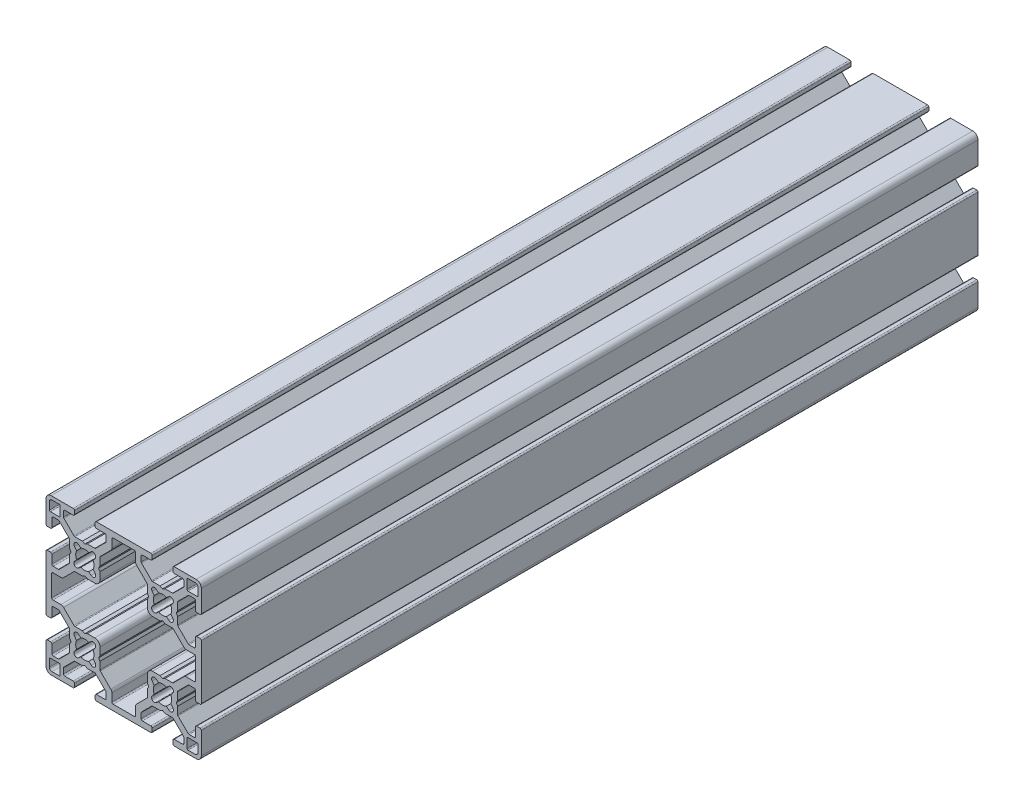
from build123d import *

# Parameters (mm, degrees)
EXTRUDE1_DEPTH = 300


with BuildPart() as part:
    # Sketch1 → Extrude1 (new body)
    with BuildSketch(Plane.XY):
        with BuildLine():
            Line((-44.499910604, -25.999939138), (-43.242439395, -25.999939138))
            ThreePointArc((-43.242439395, -25.999939138), (-42.888886712, -25.853492822), (-42.742440395, -25.499940138))
            Line((-42.742440395, -25.499940138), (-42.742440395, -22.267405228))
            ThreePointArc((-42.742440395, -22.267405228), (-42.602415161, -21.902627025), (-42.242745981, -21.749956517))
            Line((-42.242745981, -21.749956517), (-40.260148569, -21.749956517))
            ThreePointArc((-40.260148569, -21.749956517), (-40.068807235, -21.788016674), (-39.906595885, -21.896402833))
            Line((-39.906595885, -21.896402833), (-35.981069743, -25.821928975))
            ThreePointArc((-35.981069743, -25.821928975), (-35.872683584, -25.984140325), (-35.834623427, -26.175481659))
            Line((-35.834623427, -26.175481659), (-35.834623427, -29.112441775))
            Line((-35.834623427, -29.112441775), (-35.324624435, -30.062439875))
            Line((-35.324624435, -30.062439875), (-35.834623427, -31.012437975))
            Line((-35.834623427, -31.012437975), (-35.834623427, -33.824398373))
            ThreePointArc((-35.834623427, -33.824398373), (-35.872683584, -34.015739706), (-35.981069743, -34.177951056))
            Line((-35.981069743, -34.177951056), (-39.906595885, -38.103477198))
            ThreePointArc((-39.906595885, -38.103477198), (-40.068807235, -38.211863357), (-40.260148569, -38.249923515))
            Line((-40.260148569, -38.249923515), (-42.242745981, -38.249923515))
            ThreePointArc((-42.242745981, -38.249923515), (-42.602415161, -38.097253006), (-42.742440395, -37.732474804))
            Line((-42.742440395, -37.732474804), (-42.742440395, -34.499939893))
            ThreePointArc((-42.742440395, -34.499939893), (-42.888886712, -34.14638721), (-43.242439395, -33.999940893))
            Line((-43.242439395, -33.999940893), (-44.499910604, -33.999940893))
            ThreePointArc((-44.499910604, -33.999940893), (-44.853463287, -34.14638721), (-44.999909604, -34.499939893))
            Line((-44.999909604, -34.499939893), (-44.999909604, -42.999913979))
            ThreePointArc((-44.999909604, -42.999913979), (-44.414124448, -44.414124448), (-42.999913979, -44.999909604))
            Line((-42.999913979, -44.999909604), (-34.499939893, -44.999909604))
            ThreePointArc((-34.499939893, -44.999909604), (-34.14638721, -44.853463287), (-33.999940893, -44.499910604))
            Line((-33.999940893, -44.499910604), (-33.999940893, -43.242439395))
            ThreePointArc((-33.999940893, -43.242439395), (-34.14638721, -42.888886712), (-34.499939893, -42.742440395))
            Line((-34.499939893, -42.742440395), (-37.732474804, -42.742440395))
            ThreePointArc((-37.732474804, -42.742440395), (-38.097253006, -42.602415161), (-38.249923515, -42.242745981))
            Line((-38.249923515, -42.242745981), (-38.249923515, -40.260148569))
            ThreePointArc((-38.249923515, -40.260148569), (-38.211863357, -40.068807235), (-38.103477198, -39.906595885))
            Line((-38.103477198, -39.906595885), (-34.177951056, -35.981069743))
            ThreePointArc((-34.177951056, -35.981069743), (-34.015739706, -35.872683584), (-33.824398373, -35.834623427))
            Line((-33.824398373, -35.834623427), (-30.9499381, -35.834623427))
            Line((-30.9499381, -35.834623427), (-29.999940016, -35.324624405))
            Line((-29.999940016, -35.324624405), (-29.049941932, -35.834623427))
            Line((-29.049941932, -35.834623427), (-26.175481659, -35.834623427))
            ThreePointArc((-26.175481659, -35.834623427), (-25.984140325, -35.872683584), (-25.821928975, -35.981069743))
            Line((-25.821928975, -35.981069743), (-21.896402833, -39.906595885))
            ThreePointArc((-21.896402833, -39.906595885), (-21.788016674, -40.068807235), (-21.749956517, -40.260148569))
            Line((-21.749956517, -40.260148569), (-21.749956517, -42.242745981))
            ThreePointArc((-21.749956517, -42.242745981), (-21.902627025, -42.602415161), (-22.267405228, -42.742440395))
            Line((-22.267405228, -42.742440395), (-25.499940138, -42.742440395))
            ThreePointArc((-25.499940138, -42.742440395), (-25.853492822, -42.888886712), (-25.999939138, -43.242439395))
            Line((-25.999939138, -43.242439395), (-25.999939138, -44.499910604))
            ThreePointArc((-25.999939138, -44.499910604), (-25.853492822, -44.853463287), (-25.499940138, -44.999909604))
            Line((-25.499940138, -44.999909604), (-4.499999878, -44.999909604))
            ThreePointArc((-4.499999878, -44.999909604), (-4.146447194, -44.853463287), (-4.000000878, -44.499910604))
            Line((-4.000000878, -44.499910604), (-4.000000878, -43.242439395))
            ThreePointArc((-4.000000878, -43.242439395), (-4.146447194, -42.888886712), (-4.499999878, -42.742440395))
            Line((-4.499999878, -42.742440395), (-7.732534789, -42.742440395))
            ThreePointArc((-7.732534789, -42.742440395), (-8.097312991, -42.602415161), (-8.2499835, -42.242745981))
            Line((-8.2499835, -42.242745981), (-8.2499835, -40.260148569))
            ThreePointArc((-8.2499835, -40.260148569), (-8.211923342, -40.068807235), (-8.103537183, -39.906595885))
            Line((-8.103537183, -39.906595885), (-4.178011041, -35.981069743))
            ThreePointArc((-4.178011041, -35.981069743), (-4.015799691, -35.872683584), (-3.824458357, -35.834623427))
            Line((-3.824458357, -35.834623427), (-0.949998085, -35.834623427))
            Line((-0.949998085, -35.834623427), (0, -35.324624405))
            Line((0, -35.324624405), (0.949998084, -35.834623427))
            Line((0.949998084, -35.834623427), (3.824458357, -35.834623427))
            ThreePointArc((3.824458357, -35.834623427), (4.01579969, -35.872683584), (4.17801104, -35.981069743))
            Line((4.17801104, -35.981069743), (8.103537182, -39.906595885))
            ThreePointArc((8.103537182, -39.906595885), (8.211923341, -40.068807235), (8.249983499, -40.260148569))
            Line((8.249983499, -40.260148569), (8.249983499, -42.242745981))
            ThreePointArc((8.249983499, -42.242745981), (8.09731299, -42.602415161), (7.732534788, -42.742440395))
            Line((7.732534788, -42.742440395), (4.499999877, -42.742440395))
            ThreePointArc((4.499999877, -42.742440395), (4.146447193, -42.888886712), (4.000000877, -43.242439395))
            Line((4.000000877, -43.242439395), (4.000000877, -44.499910604))
            ThreePointArc((4.000000877, -44.499910604), (4.146447193, -44.853463287), (4.499999877, -44.999909604))
            Line((4.499999877, -44.999909604), (12.999973963, -44.999909604))
            ThreePointArc((12.999973963, -44.999909604), (14.414184432, -44.414124448), (14.999969588, -42.999913979))
            Line((14.999969588, -42.999913979), (14.999969588, -34.499939893))
            ThreePointArc((14.999969588, -34.499939893), (14.853523271, -34.14638721), (14.499970588, -33.999940893))
            Line((14.499970588, -33.999940893), (13.242499379, -33.999940893))
            ThreePointArc((13.242499379, -33.999940893), (12.888946695, -34.14638721), (12.742500379, -34.499939893))
            Line((12.742500379, -34.499939893), (12.742500379, -37.732474804))
            ThreePointArc((12.742500379, -37.732474804), (12.602475145, -38.097253006), (12.242805965, -38.249923515))
            Line((12.242805965, -38.249923515), (10.260208553, -38.249923515))
            ThreePointArc((10.260208553, -38.249923515), (10.068867219, -38.211863357), (9.906655869, -38.103477198))
            Line((9.906655869, -38.103477198), (5.981129727, -34.177951056))
            ThreePointArc((5.981129727, -34.177951056), (5.872743568, -34.015739706), (5.834683411, -33.824398373))
            Line((5.834683411, -33.824398373), (5.834683411, -31.012437975))
            Line((5.834683411, -31.012437975), (5.324684418, -30.062439875))
            Line((5.324684418, -30.062439875), (5.834683411, -29.112441775))
            Line((5.834683411, -29.112441775), (5.834683411, -26.175481659))
            ThreePointArc((5.834683411, -26.175481659), (5.872743568, -25.984140325), (5.981129727, -25.821928975))
            Line((5.981129727, -25.821928975), (9.906655869, -21.896402833))
            ThreePointArc((9.906655869, -21.896402833), (10.068867219, -21.788016674), (10.260208553, -21.749956517))
            Line((10.260208553, -21.749956517), (12.242805965, -21.749956517))
            ThreePointArc((12.242805965, -21.749956517), (12.602475145, -21.902627025), (12.742500379, -22.267405228))
            Line((12.742500379, -22.267405228), (12.742500379, -25.499940138))
            ThreePointArc((12.742500379, -25.499940138), (12.888946695, -25.853492822), (13.242499379, -25.999939138))
            Line((13.242499379, -25.999939138), (14.499970588, -25.999939138))
            ThreePointArc((14.499970588, -25.999939138), (14.853523271, -25.853492822), (14.999969588, -25.499940138))
            Line((14.999969588, -25.499940138), (14.999969588, -4.499999878))
            ThreePointArc((14.999969588, -4.499999878), (14.853523271, -4.146447194), (14.499970588, -4.000000878))
            Line((14.499970588, -4.000000878), (13.242499379, -4.000000878))
            ThreePointArc((13.242499379, -4.000000878), (12.888946695, -4.146447194), (12.742500379, -4.499999878))
            Line((12.742500379, -4.499999878), (12.742500379, -7.732534789))
            ThreePointArc((12.742500379, -7.732534789), (12.602475145, -8.097312991), (12.242805965, -8.2499835))
            Line((12.242805965, -8.2499835), (10.260208553, -8.2499835))
            ThreePointArc((10.260208553, -8.2499835), (10.068867219, -8.211923342), (9.906655869, -8.103537183))
            Line((9.906655869, -8.103537183), (5.981129727, -4.178011041))
            ThreePointArc((5.981129727, -4.178011041), (5.872743568, -4.015799691), (5.834683411, -3.824458357))
            Line((5.834683411, -3.824458357), (5.834683411, -1.01249796))
            Line((5.834683411, -1.01249796), (5.324684418, -0.06249986))
            Line((5.324684418, -0.06249986), (5.834683411, 0.88749824))
            Line((5.834683411, 0.88749824), (5.834683411, 3.824458357))
            ThreePointArc((5.834683411, 3.824458357), (5.872743568, 4.01579969), (5.981129727, 4.17801104))
            Line((5.981129727, 4.17801104), (9.906655869, 8.103537182))
            ThreePointArc((9.906655869, 8.103537182), (10.068867219, 8.211923341), (10.260208553, 8.249983499))
            Line((10.260208553, 8.249983499), (12.242805965, 8.249983499))
            ThreePointArc((12.242805965, 8.249983499), (12.602475145, 8.09731299), (12.742500379, 7.732534788))
            Line((12.742500379, 7.732534788), (12.742500379, 4.499999877))
            ThreePointArc((12.742500379, 4.499999877), (12.888946695, 4.146447193), (13.242499379, 4.000000877))
            Line((13.242499379, 4.000000877), (14.499970588, 4.000000877))
            ThreePointArc((14.499970588, 4.000000877), (14.853523271, 4.146447193), (14.999969588, 4.499999877))
            Line((14.999969588, 4.499999877), (14.999969588, 12.999973963))
            ThreePointArc((14.999969588, 12.999973963), (14.414184432, 14.414184432), (12.999973963, 14.999969588))
            Line((12.999973963, 14.999969588), (4.499999877, 14.999969588))
            ThreePointArc((4.499999877, 14.999969588), (4.146447193, 14.853523271), (4.000000877, 14.499970588))
            Line((4.000000877, 14.499970588), (4.000000877, 13.242499379))
            ThreePointArc((4.000000877, 13.242499379), (4.146447193, 12.888946695), (4.499999877, 12.742500379))
            Line((4.499999877, 12.742500379), (7.732534788, 12.742500379))
            ThreePointArc((7.732534788, 12.742500379), (8.09731299, 12.602475145), (8.249983499, 12.242805965))
            Line((8.249983499, 12.242805965), (8.249983499, 10.260208553))
            ThreePointArc((8.249983499, 10.260208553), (8.211923341, 10.068867219), (8.103537182, 9.906655869))
            Line((8.103537182, 9.906655869), (4.17801104, 5.981129727))
            ThreePointArc((4.17801104, 5.981129727), (4.01579969, 5.872743568), (3.824458357, 5.834683411))
            Line((3.824458357, 5.834683411), (0.949998084, 5.834683411))
            Line((0.949998084, 5.834683411), (0, 5.324684389))
            Line((0, 5.324684389), (-0.949998085, 5.834683411))
            Line((-0.949998085, 5.834683411), (-3.824458357, 5.834683411))
            ThreePointArc((-3.824458357, 5.834683411), (-4.015799691, 5.872743568), (-4.178011041, 5.981129727))
            Line((-4.178011041, 5.981129727), (-8.103537183, 9.906655869))
            ThreePointArc((-8.103537183, 9.906655869), (-8.211923342, 10.068867219), (-8.2499835, 10.260208553))
            Line((-8.2499835, 10.260208553), (-8.2499835, 12.242805965))
            ThreePointArc((-8.2499835, 12.242805965), (-8.097312991, 12.602475145), (-7.732534789, 12.742500379))
            Line((-7.732534789, 12.742500379), (-4.499999878, 12.742500379))
            ThreePointArc((-4.499999878, 12.742500379), (-4.146447194, 12.888946695), (-4.000000878, 13.242499379))
            Line((-4.000000878, 13.242499379), (-4.000000878, 14.499970588))
            ThreePointArc((-4.000000878, 14.499970588), (-4.146447194, 14.853523271), (-4.499999878, 14.999969588))
            Line((-4.499999878, 14.999969588), (-25.499940138, 14.999969588))
            ThreePointArc((-25.499940138, 14.999969588), (-25.853492822, 14.853523271), (-25.999939138, 14.499970588))
            Line((-25.999939138, 14.499970588), (-25.999939138, 13.242499379))
            ThreePointArc((-25.999939138, 13.242499379), (-25.853492822, 12.888946695), (-25.499940138, 12.742500379))
            Line((-25.499940138, 12.742500379), (-22.267405228, 12.742500379))
            ThreePointArc((-22.267405228, 12.742500379), (-21.902627025, 12.602475145), (-21.749956517, 12.242805965))
            Line((-21.749956517, 12.242805965), (-21.749956517, 10.260208553))
            ThreePointArc((-21.749956517, 10.260208553), (-21.788016674, 10.068867219), (-21.896402833, 9.906655869))
            Line((-21.896402833, 9.906655869), (-25.821928975, 5.981129727))
            ThreePointArc((-25.821928975, 5.981129727), (-25.984140325, 5.872743568), (-26.175481659, 5.834683411))
            Line((-26.175481659, 5.834683411), (-29.049941932, 5.834683411))
            Line((-29.049941932, 5.834683411), (-29.999940016, 5.324684389))
            Line((-29.999940016, 5.324684389), (-30.9499381, 5.834683411))
            Line((-30.9499381, 5.834683411), (-33.824398373, 5.834683411))
            ThreePointArc((-33.824398373, 5.834683411), (-34.015739706, 5.872743568), (-34.177951056, 5.981129727))
            Line((-34.177951056, 5.981129727), (-38.103477198, 9.906655869))
            ThreePointArc((-38.103477198, 9.906655869), (-38.211863357, 10.068867219), (-38.249923515, 10.260208553))
            Line((-38.249923515, 10.260208553), (-38.249923515, 12.242805965))
            ThreePointArc((-38.249923515, 12.242805965), (-38.097253006, 12.602475145), (-37.732474804, 12.742500379))
            Line((-37.732474804, 12.742500379), (-34.499939893, 12.742500379))
            ThreePointArc((-34.499939893, 12.742500379), (-34.14638721, 12.888946695), (-33.999940893, 13.242499379))
            Line((-33.999940893, 13.242499379), (-33.999940893, 14.499970588))
            ThreePointArc((-33.999940893, 14.499970588), (-34.14638721, 14.853523271), (-34.499939893, 14.999969588))
            Line((-34.499939893, 14.999969588), (-42.999913979, 14.999969588))
            ThreePointArc((-42.999913979, 14.999969588), (-44.414124448, 14.414184432), (-44.999909604, 12.999973963))
            Line((-44.999909604, 12.999973963), (-44.999909604, 4.499999877))
            ThreePointArc((-44.999909604, 4.499999877), (-44.853463287, 4.146447193), (-44.499910604, 4.000000877))
            Line((-44.499910604, 4.000000877), (-43.242439395, 4.000000877))
            ThreePointArc((-43.242439395, 4.000000877), (-42.888886712, 4.146447193), (-42.742440395, 4.499999877))
            Line((-42.742440395, 4.499999877), (-42.742440395, 7.732534788))
            ThreePointArc((-42.742440395, 7.732534788), (-42.602415161, 8.09731299), (-42.242745981, 8.249983499))
            Line((-42.242745981, 8.249983499), (-40.260148569, 8.249983499))
            ThreePointArc((-40.260148569, 8.249983499), (-40.068807235, 8.211923341), (-39.906595885, 8.103537182))
            Line((-39.906595885, 8.103537182), (-35.981069743, 4.17801104))
            ThreePointArc((-35.981069743, 4.17801104), (-35.872683584, 4.01579969), (-35.834623427, 3.824458357))
            Line((-35.834623427, 3.824458357), (-35.834623427, 0.88749824))
            Line((-35.834623427, 0.88749824), (-35.324624435, -0.06249986))
            Line((-35.324624435, -0.06249986), (-35.834623427, -1.01249796))
            Line((-35.834623427, -1.01249796), (-35.834623427, -3.824458357))
            ThreePointArc((-35.834623427, -3.824458357), (-35.872683584, -4.015799691), (-35.981069743, -4.178011041))
            Line((-35.981069743, -4.178011041), (-39.906595885, -8.103537183))
            ThreePointArc((-39.906595885, -8.103537183), (-40.068807235, -8.211923342), (-40.260148569, -8.2499835))
            Line((-40.260148569, -8.2499835), (-42.242745981, -8.2499835))
            ThreePointArc((-42.242745981, -8.2499835), (-42.602415161, -8.097312991), (-42.742440395, -7.732534789))
            Line((-42.742440395, -7.732534789), (-42.742440395, -4.499999878))
            ThreePointArc((-42.742440395, -4.499999878), (-42.888886712, -4.146447194), (-43.242439395, -4.000000878))
            Line((-43.242439395, -4.000000878), (-44.499910604, -4.000000878))
            ThreePointArc((-44.499910604, -4.000000878), (-44.853463287, -4.146447194), (-44.999909604, -4.499999878))
            Line((-44.999909604, -4.499999878), (-44.999909604, -25.499940138))
            ThreePointArc((-44.999909604, -25.499940138), (-44.853463287, -25.853492822), (-44.499910604, -25.999939138))
        make_face()
        with BuildLine():
            Line((12.7999744, -19.0499619), (12.7999744, -10.9499781))
            ThreePointArc((12.7999744, -10.9499781), (12.653528083, -10.596425417), (12.2999754, -10.4499791))
            Line((12.2999754, -10.4499791), (9.268179515, -10.4499791))
            ThreePointArc((9.268179515, -10.4499791), (8.694155515, -10.335798627), (8.207521465, -10.010640151))
            Line((8.207521465, -10.010640151), (4.178011045, -5.981129731))
            ThreePointArc((4.178011045, -5.981129731), (4.015799695, -5.872743572), (3.824458362, -5.834683414))
            Line((3.824458362, -5.834683414), (0.949998089, -5.834683414))
            Line((0.949998089, -5.834683414), (-1.6e-08, -5.324684432))
            Line((-1.6e-08, -5.324684432), (-0.949998121, -5.834683414))
            Line((-0.949998121, -5.834683414), (-3.83468779, -5.834683414))
            ThreePointArc((-3.83468779, -5.834683414), (-5.248898258, -5.248898258), (-5.834683414, -3.83468779))
            Line((-5.834683414, -3.83468779), (-5.834683414, -1.012497965))
            Line((-5.834683414, -1.012497965), (-5.324684432, -0.06249986))
            Line((-5.324684432, -0.06249986), (-5.834683414, 0.887498245))
            Line((-5.834683414, 0.887498245), (-5.834683414, 3.824458362))
            ThreePointArc((-5.834683414, 3.824458362), (-5.872743572, 4.015799695), (-5.981129731, 4.178011045))
            Line((-5.981129731, 4.178011045), (-10.01064015, 8.207521465))
            ThreePointArc((-10.01064015, 8.207521465), (-10.335798627, 8.694155515), (-10.4499791, 9.268179515))
            Line((-10.4499791, 9.268179515), (-10.4499791, 12.2999754))
            ThreePointArc((-10.4499791, 12.2999754), (-10.596425417, 12.653528083), (-10.9499781, 12.7999744))
            Line((-10.9499781, 12.7999744), (-19.0499619, 12.7999744))
            ThreePointArc((-19.0499619, 12.7999744), (-19.403514583, 12.653528083), (-19.5499609, 12.2999754))
            Line((-19.5499609, 12.2999754), (-19.5499609, 9.268179515))
            ThreePointArc((-19.5499609, 9.268179515), (-19.664141373, 8.694155515), (-19.98929985, 8.207521465))
            Line((-19.98929985, 8.207521465), (-24.018810269, 4.178011045))
            ThreePointArc((-24.018810269, 4.178011045), (-24.127196428, 4.015799695), (-24.165256586, 3.824458362))
            Line((-24.165256586, 3.824458362), (-24.165256586, 0.887498245))
            Line((-24.165256586, 0.887498245), (-24.675255568, -0.06249986))
            Line((-24.675255568, -0.06249986), (-24.165256586, -1.012497965))
            Line((-24.165256586, -1.012497965), (-24.165256586, -3.83468779))
            ThreePointArc((-24.165256586, -3.83468779), (-24.751041742, -5.248898258), (-26.16525221, -5.834683414))
            Line((-26.16525221, -5.834683414), (-29.049941879, -5.834683414))
            Line((-29.049941879, -5.834683414), (-29.999939984, -5.324684432))
            Line((-29.999939984, -5.324684432), (-30.949938089, -5.834683414))
            Line((-30.949938089, -5.834683414), (-33.824398362, -5.834683414))
            ThreePointArc((-33.824398362, -5.834683414), (-34.015739695, -5.872743572), (-34.177951045, -5.981129731))
            Line((-34.177951045, -5.981129731), (-38.207461465, -10.010640151))
            ThreePointArc((-38.207461465, -10.010640151), (-38.694095515, -10.335798627), (-39.268119515, -10.4499791))
            Line((-39.268119515, -10.4499791), (-42.2999154, -10.4499791))
            ThreePointArc((-42.2999154, -10.4499791), (-42.653468083, -10.596425417), (-42.7999144, -10.9499781))
            Line((-42.7999144, -10.9499781), (-42.7999144, -19.0499619))
            ThreePointArc((-42.7999144, -19.0499619), (-42.653468083, -19.403514584), (-42.2999154, -19.5499609))
            Line((-42.2999154, -19.5499609), (-39.268119515, -19.5499609))
            ThreePointArc((-39.268119515, -19.5499609), (-38.694095515, -19.664141373), (-38.207461465, -19.98929985))
            Line((-38.207461465, -19.98929985), (-34.177951045, -24.018810269))
            ThreePointArc((-34.177951045, -24.018810269), (-34.015739695, -24.127196428), (-33.824398362, -24.165256586))
            Line((-33.824398362, -24.165256586), (-30.949938089, -24.165256586))
            Line((-30.949938089, -24.165256586), (-29.999939984, -24.675255568))
            Line((-29.999939984, -24.675255568), (-29.049941879, -24.165256586))
            Line((-29.049941879, -24.165256586), (-26.16525221, -24.165256586))
            ThreePointArc((-26.16525221, -24.165256586), (-24.751041742, -24.751041742), (-24.165256586, -26.16525221))
            Line((-24.165256586, -26.16525221), (-24.165256586, -29.112441754))
            Line((-24.165256586, -29.112441754), (-24.675255568, -30.062439859))
            Line((-24.675255568, -30.062439859), (-24.165256586, -31.012437964))
            Line((-24.165256586, -31.012437964), (-24.165256586, -33.824398362))
            ThreePointArc((-24.165256586, -33.824398362), (-24.127196428, -34.015739695), (-24.018810269, -34.177951045))
            Line((-24.018810269, -34.177951045), (-19.98929985, -38.207461465))
            ThreePointArc((-19.98929985, -38.207461465), (-19.664141373, -38.694095515), (-19.5499609, -39.268119515))
            Line((-19.5499609, -39.268119515), (-19.5499609, -42.2999154))
            ThreePointArc((-19.5499609, -42.2999154), (-19.403514583, -42.653468084), (-19.0499619, -42.7999144))
            Line((-19.0499619, -42.7999144), (-10.9499781, -42.7999144))
            ThreePointArc((-10.9499781, -42.7999144), (-10.596425417, -42.653468084), (-10.4499791, -42.2999154))
            Line((-10.4499791, -42.2999154), (-10.4499791, -39.268119515))
            ThreePointArc((-10.4499791, -39.268119515), (-10.335798627, -38.694095515), (-10.01064015, -38.207461465))
            Line((-10.01064015, -38.207461465), (-5.981129731, -34.177951045))
            ThreePointArc((-5.981129731, -34.177951045), (-5.872743572, -34.015739695), (-5.834683414, -33.824398362))
            Line((-5.834683414, -33.824398362), (-5.834683414, -31.012437964))
            Line((-5.834683414, -31.012437964), (-5.324684432, -30.062439859))
            Line((-5.324684432, -30.062439859), (-5.834683414, -29.112441754))
            Line((-5.834683414, -29.112441754), (-5.834683414, -26.16525221))
            ThreePointArc((-5.834683414, -26.16525221), (-5.248898258, -24.751041742), (-3.83468779, -24.165256586))
            Line((-3.83468779, -24.165256586), (-0.949998121, -24.165256586))
            Line((-0.949998121, -24.165256586), (-1.6e-08, -24.675255568))
            Line((-1.6e-08, -24.675255568), (0.949998089, -24.165256586))
            Line((0.949998089, -24.165256586), (3.824458362, -24.165256586))
            ThreePointArc((3.824458362, -24.165256586), (4.015799695, -24.127196428), (4.178011045, -24.018810269))
            Line((4.178011045, -24.018810269), (8.207521465, -19.98929985))
            ThreePointArc((8.207521465, -19.98929985), (8.694155515, -19.664141373), (9.268179515, -19.5499609))
            Line((9.268179515, -19.5499609), (12.2999754, -19.5499609))
            ThreePointArc((12.2999754, -19.5499609), (12.653528083, -19.403514584), (12.7999744, -19.0499619))
        make_face(mode=Mode.SUBTRACT)
        with BuildLine():
            Line((-2.473346769, -33.979875105), (-1.494228237, -33.198085108))
            ThreePointArc((-1.494228237, -33.198085108), (0, -33.52993294), (1.494228236, -33.198085108))
            Line((1.494228236, -33.198085108), (2.473346769, -33.979875105))
            ThreePointArc((2.473346769, -33.979875105), (3.900235502, -33.900175502), (3.979935105, -32.473286769))
            Line((3.979935105, -32.473286769), (3.198145108, -31.494168236))
            ThreePointArc((3.198145108, -31.494168236), (3.52999294, -29.99994), (3.198145108, -28.505711763))
            Line((3.198145108, -28.505711763), (3.979935105, -27.526593231))
            ThreePointArc((3.979935105, -27.526593231), (3.900235502, -26.099704498), (2.473346769, -26.020004895))
            Line((2.473346769, -26.020004895), (1.494228237, -26.801794892))
            ThreePointArc((1.494228237, -26.801794892), (0, -26.46994706), (-1.494228237, -26.801794892))
            Line((-1.494228237, -26.801794892), (-2.473346769, -26.020004895))
            ThreePointArc((-2.473346769, -26.020004895), (-3.900235502, -26.099704498), (-3.979935105, -27.526593231))
            Line((-3.979935105, -27.526593231), (-3.198145108, -28.505711763))
            ThreePointArc((-3.198145108, -28.505711763), (-3.52999294, -29.99994), (-3.198145108, -31.494168236))
            Line((-3.198145108, -31.494168236), (-3.979935105, -32.473286769))
            ThreePointArc((-3.979935105, -32.473286769), (-3.900235502, -33.900175502), (-2.473346769, -33.979875105))
        make_face(mode=Mode.SUBTRACT)
        with BuildLine():
            Line((-32.473286769, -33.979875105), (-31.494168237, -33.198085108))
            ThreePointArc((-31.494168237, -33.198085108), (-29.99994, -33.52993294), (-28.505711764, -33.198085108))
            Line((-28.505711764, -33.198085108), (-27.526593231, -33.979875105))
            ThreePointArc((-27.526593231, -33.979875105), (-26.099704498, -33.900175502), (-26.020004895, -32.473286769))
            Line((-26.020004895, -32.473286769), (-26.801794892, -31.494168236))
            ThreePointArc((-26.801794892, -31.494168236), (-26.46994706, -29.99994), (-26.801794892, -28.505711763))
            Line((-26.801794892, -28.505711763), (-26.020004895, -27.526593231))
            ThreePointArc((-26.020004895, -27.526593231), (-26.099704498, -26.099704498), (-27.526593231, -26.020004895))
            Line((-27.526593231, -26.020004895), (-28.505711763, -26.801794892))
            ThreePointArc((-28.505711763, -26.801794892), (-29.99994, -26.46994706), (-31.494168237, -26.801794892))
            Line((-31.494168237, -26.801794892), (-32.473286769, -26.020004895))
            ThreePointArc((-32.473286769, -26.020004895), (-33.900175502, -26.099704498), (-33.979875105, -27.526593231))
            Line((-33.979875105, -27.526593231), (-33.198085108, -28.505711763))
            ThreePointArc((-33.198085108, -28.505711763), (-33.52993294, -29.99994), (-33.198085108, -31.494168236))
            Line((-33.198085108, -31.494168236), (-33.979875106, -32.473286769))
            ThreePointArc((-33.979875106, -32.473286769), (-33.900175502, -33.900175502), (-32.473286769, -33.979875105))
        make_face(mode=Mode.SUBTRACT)
        with BuildLine():
            Line((-2.473346769, -3.979935105), (-1.494228237, -3.198145108))
            ThreePointArc((-1.494228237, -3.198145108), (0, -3.52999294), (1.494228236, -3.198145108))
            Line((1.494228236, -3.198145108), (2.473346769, -3.979935105))
            ThreePointArc((2.473346769, -3.979935105), (3.900235502, -3.900235502), (3.979935105, -2.473346769))
            Line((3.979935105, -2.473346769), (3.198145108, -1.494228236))
            ThreePointArc((3.198145108, -1.494228236), (3.52999294, 0), (3.198145108, 1.494228237))
            Line((3.198145108, 1.494228237), (3.979935105, 2.473346769))
            ThreePointArc((3.979935105, 2.473346769), (3.900235502, 3.900235502), (2.473346769, 3.979935105))
            Line((2.473346769, 3.979935105), (1.494228237, 3.198145108))
            ThreePointArc((1.494228237, 3.198145108), (0, 3.52999294), (-1.494228237, 3.198145108))
            Line((-1.494228237, 3.198145108), (-2.473346769, 3.979935105))
            ThreePointArc((-2.473346769, 3.979935105), (-3.900235502, 3.900235502), (-3.979935105, 2.473346769))
            Line((-3.979935105, 2.473346769), (-3.198145108, 1.494228237))
            ThreePointArc((-3.198145108, 1.494228237), (-3.52999294, 0), (-3.198145108, -1.494228236))
            Line((-3.198145108, -1.494228236), (-3.979935105, -2.473346769))
            ThreePointArc((-3.979935105, -2.473346769), (-3.900235502, -3.900235502), (-2.473346769, -3.979935105))
        make_face(mode=Mode.SUBTRACT)
        with BuildLine():
            Line((-32.473286769, -3.979935105), (-31.494168237, -3.198145108))
            ThreePointArc((-31.494168237, -3.198145108), (-29.99994, -3.52999294), (-28.505711764, -3.198145108))
            Line((-28.505711764, -3.198145108), (-27.526593231, -3.979935105))
            ThreePointArc((-27.526593231, -3.979935105), (-26.099704498, -3.900235502), (-26.020004895, -2.473346769))
            Line((-26.020004895, -2.473346769), (-26.801794892, -1.494228236))
            ThreePointArc((-26.801794892, -1.494228236), (-26.46994706, 0), (-26.801794892, 1.494228237))
            Line((-26.801794892, 1.494228237), (-26.020004895, 2.473346769))
            ThreePointArc((-26.020004895, 2.473346769), (-26.099704498, 3.900235502), (-27.526593231, 3.979935105))
            Line((-27.526593231, 3.979935105), (-28.505711763, 3.198145108))
            ThreePointArc((-28.505711763, 3.198145108), (-29.99994, 3.52999294), (-31.494168237, 3.198145108))
            Line((-31.494168237, 3.198145108), (-32.473286769, 3.979935105))
            ThreePointArc((-32.473286769, 3.979935105), (-33.900175502, 3.900235502), (-33.979875105, 2.473346769))
            Line((-33.979875105, 2.473346769), (-33.198085108, 1.494228237))
            ThreePointArc((-33.198085108, 1.494228237), (-33.52993294, 0), (-33.198085108, -1.494228236))
            Line((-33.198085108, -1.494228236), (-33.979875105, -2.473346769))
            ThreePointArc((-33.979875105, -2.473346769), (-33.900175502, -3.900235502), (-32.473286769, -3.979935105))
        make_face(mode=Mode.SUBTRACT)
        with BuildLine():
            Line((-39.499921, 9.87998024), (-39.499921, 13.318973362))
            ThreePointArc((-39.499921, 13.318973362), (-39.611513093, 13.588380507), (-39.880920238, 13.6999726))
            Line((-39.880920238, 13.6999726), (-42.6999146, 13.6999726))
            ThreePointArc((-42.6999146, 13.6999726), (-43.407019967, 13.407079967), (-43.6999126, 12.6999746))
            Line((-43.6999126, 12.6999746), (-43.6999126, 9.880980238))
            ThreePointArc((-43.6999126, 9.880980238), (-43.588320507, 9.611573093), (-43.318913362, 9.499981))
            Line((-43.318913362, 9.499981), (-39.87992024, 9.499981))
            ThreePointArc((-39.87992024, 9.499981), (-39.611220201, 9.611280201), (-39.499921, 9.87998024))
        make_face(mode=Mode.SUBTRACT)
        with BuildLine():
            Line((12.6999746, 13.6999726), (9.880980238, 13.6999726))
            ThreePointArc((9.880980238, 13.6999726), (9.611573093, 13.588380507), (9.499981, 13.318973362))
            Line((9.499981, 13.318973362), (9.499981, 9.87998024))
            ThreePointArc((9.499981, 9.87998024), (9.611280201, 9.611280201), (9.87998024, 9.499981))
            Line((9.87998024, 9.499981), (13.318973362, 9.499981))
            ThreePointArc((13.318973362, 9.499981), (13.588380507, 9.611573093), (13.6999726, 9.880980238))
            Line((13.6999726, 9.880980238), (13.6999726, 12.6999746))
            ThreePointArc((13.6999726, 12.6999746), (13.407079967, 13.407079967), (12.6999746, 13.6999726))
        make_face(mode=Mode.SUBTRACT)
        with BuildLine():
            Line((9.499981, -39.87992024), (9.499981, -43.318913362))
            ThreePointArc((9.499981, -43.318913362), (9.611573093, -43.588320507), (9.880980238, -43.6999126))
            Line((9.880980238, -43.6999126), (12.6999746, -43.6999126))
            ThreePointArc((12.6999746, -43.6999126), (13.407079967, -43.407019967), (13.6999726, -42.6999146))
            Line((13.6999726, -42.6999146), (13.6999726, -39.880920238))
            ThreePointArc((13.6999726, -39.880920238), (13.588380507, -39.611513093), (13.318973362, -39.499921))
            Line((13.318973362, -39.499921), (9.87998024, -39.499921))
            ThreePointArc((9.87998024, -39.499921), (9.611280201, -39.611220201), (9.499981, -39.87992024))
        make_face(mode=Mode.SUBTRACT)
        with BuildLine():
            Line((-39.87992024, -39.499921), (-43.318913362, -39.499921))
            ThreePointArc((-43.318913362, -39.499921), (-43.588320507, -39.611513093), (-43.6999126, -39.880920238))
            Line((-43.6999126, -39.880920238), (-43.6999126, -42.6999146))
            ThreePointArc((-43.6999126, -42.6999146), (-43.407019967, -43.407019967), (-42.6999146, -43.6999126))
            Line((-42.6999146, -43.6999126), (-39.880920238, -43.6999126))
            ThreePointArc((-39.880920238, -43.6999126), (-39.611513093, -43.588320507), (-39.499921, -43.318913362))
            Line((-39.499921, -43.318913362), (-39.499921, -39.87992024))
            ThreePointArc((-39.499921, -39.87992024), (-39.611220201, -39.611220201), (-39.87992024, -39.499921))
        make_face(mode=Mode.SUBTRACT)
    extrude(amount=-EXTRUDE1_DEPTH)


solid = part.part
